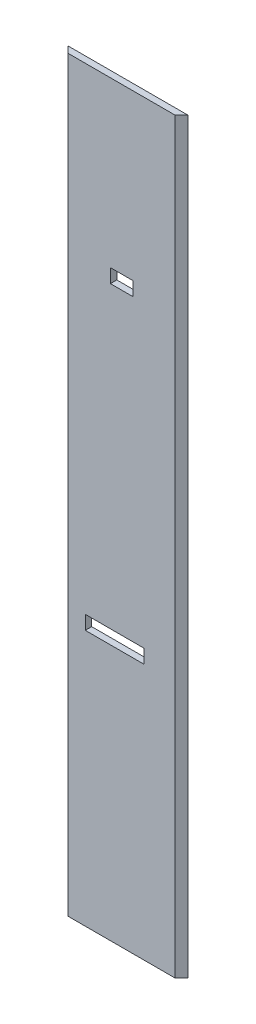
from build123d import *

# Parameters (mm, degrees)
SKETCH1_W           = 350
SKETCH1_H           = 50
BOSS_EXTRUDE1_DEPTH = 3
BOSS_EXTRUDE2_DEPTH = 350
SKETCH3_W           = 10.5
SKETCH3_H           = 6.5
CUT_EXTRUDE1_DEPTH  = 10


with BuildPart() as part:
    # Sketch1 → Boss-Extrude1 (new body)
    with BuildSketch(Plane(origin=(0, 0, 0), x_dir=(0, 1, 0), z_dir=(0, 0, 1))):
        Rectangle(SKETCH1_W, SKETCH1_H)
    extrude(amount=BOSS_EXTRUDE1_DEPTH)

    # Sketch2 → Boss-Extrude2 (add, through all)
    with BuildSketch(Plane.XZ.offset(175)):
        Polygon((-25, 3), (-25, 0), (-28, 0), align=None)
        Polygon((25, 3), (28, 0), (25, 0), align=None)
    extrude(amount=-BOSS_EXTRUDE2_DEPTH)

    # Sketch3 → Cut-Extrude1 (cut)
    with BuildSketch(Plane(origin=(0, 0, 0), x_dir=(1, 0, 0), z_dir=(0, 0, -1))):
        Polygon((0, 55), (10.5, 55), (10.5, 48.5), (-17, 48.5), (-17, 55), align=None)
        with Locations((0, -94.75)):
            Rectangle(SKETCH3_W, SKETCH3_H)
    extrude(amount=-CUT_EXTRUDE1_DEPTH, mode=Mode.SUBTRACT)


solid = part.part
